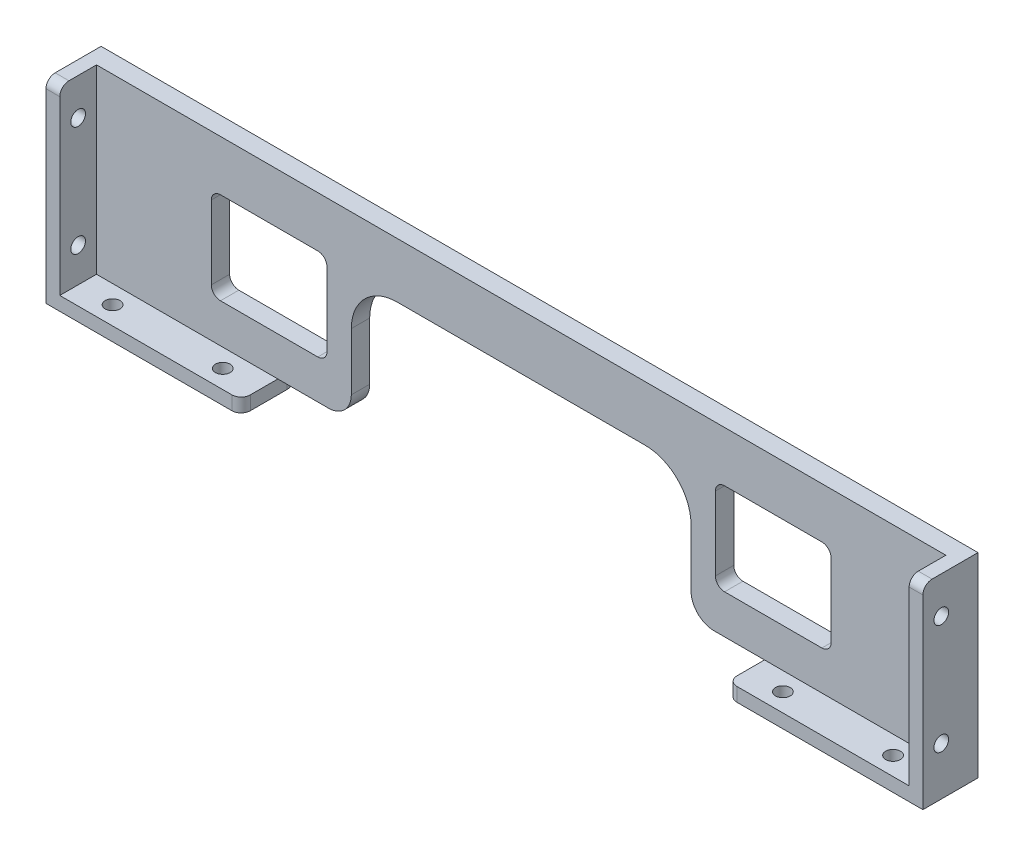
from build123d import *

# Parameters (mm, degrees)
EXTRUDE_1_DEPTH     = 12
EXTRUDE_2_DEPTH     = 4
CUT_EXTRUDE_1_REACH = 107.216
SKETCH_3_R          = 1.6
CUT_EXTRUDE_2_REACH = 107.216
SKETCH_4_R          = 1.6
FILLET_2_R          = 2
SKETCH_5_W          = 11.2
SKETCH_5_H          = 20
CUT_EXTRUDE_3_DEPTH = 20
FILLET_4_R          = 2


with BuildPart() as part:
    # 草图1 → 凸台-拉伸1 (new body)
    with BuildSketch(Plane.XY):
        Polygon((0, 42.5), (0, 0), (42.5, 0), (42.5, 3), (3, 3), (3, 42.5), align=None)
    extrude(amount=EXTRUDE_1_DEPTH)

    # 草图1<6> → 凸台-拉伸2 (add)
    with BuildSketch(Plane.XY):
        with BuildLine():
            Line((95.5, 42.5), (3, 42.5))
            Line((3, 42.5), (3, 3))
            Line((3, 3), (42.5, 3))
            Line((42.5, 3), (53.5, 3))
            ThreePointArc((53.5, 3), (57.035533906, 4.464466094), (58.5, 8))
            Line((58.5, 8), (58.5, 20.5))
            ThreePointArc((58.5, 20.5), (61.428932188, 27.571067812), (68.5, 30.5))
            Line((68.5, 30.5), (95.5, 30.5))
            Line((95.5, 30.5), (95.5, 42.5))
        make_face()
        with BuildLine():
            ThreePointArc((28, 29.5), (28.585786438, 30.914213562), (30, 31.5))
            Line((30, 31.5), (42, 31.5))
            ThreePointArc((42, 31.5), (43.414213562, 30.914213562), (44, 29.5))
            Line((44, 29.5), (44, 13.5))
            ThreePointArc((44, 13.5), (43.414213562, 12.085786438), (42, 11.5))
            Line((42, 11.5), (30, 11.5))
            ThreePointArc((30, 11.5), (28.585786438, 12.085786438), (28, 13.5))
            Line((28, 13.5), (28, 29.5))
        make_face(mode=Mode.SUBTRACT)
    extrude(amount=EXTRUDE_2_DEPTH)

    # 草图3 → 切除-拉伸1 (cut, up to next)
    with BuildSketch(Plane.ZY, mode=Mode.PRIVATE) as cut_extrude_1_sk1:
        with Locations((8, 10.5)):
            Circle(SKETCH_3_R)
    cut_extrude_1_tool1 = extrude(cut_extrude_1_sk1.sketch, amount=-CUT_EXTRUDE_1_REACH, mode=Mode.PRIVATE) & part.part
    # 草图3 → 切除-拉伸1 (cut, up to next)
    with BuildSketch(Plane.ZY, mode=Mode.PRIVATE) as cut_extrude_1_sk2:
        with Locations((8, 34.5)):
            Circle(SKETCH_3_R)
    cut_extrude_1_tool2 = extrude(cut_extrude_1_sk2.sketch, amount=-CUT_EXTRUDE_1_REACH, mode=Mode.PRIVATE) & part.part
    add(cut_extrude_1_tool1.solids().sort_by_distance((0, 10.5, 8))[0], mode=Mode.SUBTRACT)
    add(cut_extrude_1_tool2.solids().sort_by_distance((0, 34.5, 8))[0], mode=Mode.SUBTRACT)

    # 草图4 → 切除-拉伸2 (cut, up to next)
    with BuildSketch(Plane.XZ, mode=Mode.PRIVATE) as cut_extrude_2_sk1:
        with Locations((10.5, 8)):
            Circle(SKETCH_4_R)
    cut_extrude_2_tool1 = extrude(cut_extrude_2_sk1.sketch, amount=-CUT_EXTRUDE_2_REACH, mode=Mode.PRIVATE) & part.part
    # 草图4 → 切除-拉伸2 (cut, up to next)
    with BuildSketch(Plane.XZ, mode=Mode.PRIVATE) as cut_extrude_2_sk2:
        with Locations((34.5, 8)):
            Circle(SKETCH_4_R)
    cut_extrude_2_tool2 = extrude(cut_extrude_2_sk2.sketch, amount=-CUT_EXTRUDE_2_REACH, mode=Mode.PRIVATE) & part.part
    add(cut_extrude_2_tool1.solids().sort_by_distance((10.5, 0, 8))[0], mode=Mode.SUBTRACT)
    add(cut_extrude_2_tool2.solids().sort_by_distance((34.5, 0, 8))[0], mode=Mode.SUBTRACT)

    # 圆角2
    fillet_2_edges = [part.edges().sort_by_distance(p)[0] for p in [
        (1.5, 42.5, 12),
        (42.5, 1.5, 0),
        (42.5, 1.5, 12),
    ]]
    fillet(fillet_2_edges, radius=FILLET_2_R)

    # 镜向1: part across plane


with BuildPart() as part_1:
    add(part.part)
    add(part.part.mirror(Plane(origin=(95.5, 0, 4), x_dir=(0, 0, 1), z_dir=(-1, 0, 0))))

    # 草图5 → 切除-拉伸3 (cut)
    with BuildSketch(Plane.XY.offset(4)):
        with Locations((47.6, 21.5)):
            Rectangle(SKETCH_5_W, SKETCH_5_H)
        with Locations((143.4, 21.5)):
            Rectangle(SKETCH_5_W, SKETCH_5_H)
    extrude(amount=-CUT_EXTRUDE_3_DEPTH, mode=Mode.SUBTRACT)

    # 圆角4
    fillet_4_edges = [part_1.edges().sort_by_distance(p)[0] for p in [
        (137.8, 31.5, 2),
        (137.8, 11.5, 2),
        (53.2, 11.5, 2),
        (53.2, 31.5, 2),
    ]]
    fillet(fillet_4_edges, radius=FILLET_4_R)


solid = part_1.part
